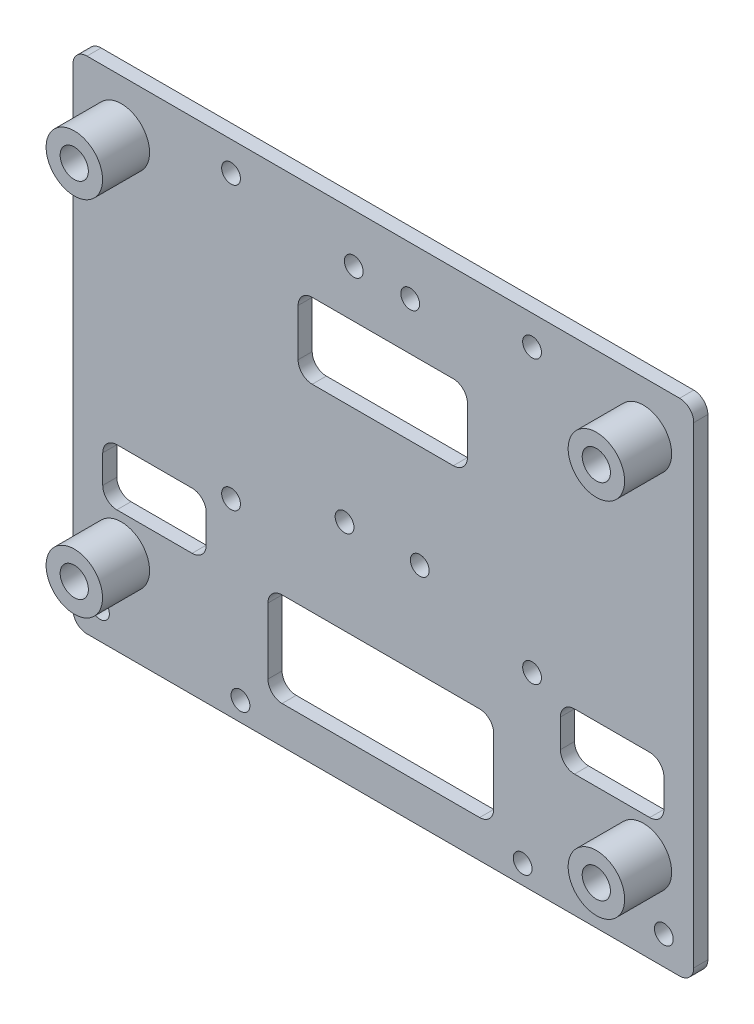
from build123d import *

# Parameters (mm, degrees)
SKETCH6_W           = 66
SKETCH6_H           = 53.2
SKETCH6_R           = 1
BOSS_EXTRUDE1_DEPTH = 1.5
SKETCH7_W           = 18
SKETCH7_H           = 8
SKETCH7_W_2         = 24
SKETCH7_H_2         = 10
SKETCH7_W_3         = 11
SKETCH7_H_3         = 6
CUT_EXTRUDE1_DEPTH  = 1.5
SKETCH8_R           = 3
BOSS_EXTRUDE2_DEPTH = 5
FILLET1_R           = 1.5
SKETCH9_R           = 1.5
CUT_EXTRUDE2_DEPTH  = 487.862929815


with BuildPart() as part:
    # Sketch6 → Boss-Extrude1 (new body)
    with BuildSketch(Plane.XY.offset(10)):
        with Locations((179.113788697, 411.579190598)):
            Rectangle(SKETCH6_W, SKETCH6_H)
        with Locations((175.972708226, 433.009408695)):
            Circle(SKETCH6_R, mode=Mode.SUBTRACT)
        with Locations((181.972708226, 433.009408695)):
            Circle(SKETCH6_R, mode=Mode.SUBTRACT)
        with Locations((174.991265937, 408.983186548)):
            Circle(SKETCH6_R, mode=Mode.SUBTRACT)
        with Locations((182.991265937, 408.983186548)):
            Circle(SKETCH6_R, mode=Mode.SUBTRACT)
        with Locations((162.926862189, 435.050185267)):
            Circle(SKETCH6_R, mode=Mode.SUBTRACT)
        with Locations((194.926862189, 435.050185267)):
            Circle(SKETCH6_R, mode=Mode.SUBTRACT)
        with Locations((162.926862189, 405.077351054)):
            Circle(SKETCH6_R, mode=Mode.SUBTRACT)
        with Locations((194.926862189, 405.077351054)):
            Circle(SKETCH6_R, mode=Mode.SUBTRACT)
        with Locations((163.926862189, 387.016819786)):
            Circle(SKETCH6_R, mode=Mode.SUBTRACT)
        with Locations((193.926862189, 387.016819786)):
            Circle(SKETCH6_R, mode=Mode.SUBTRACT)
        with Locations((148.99021815, 388.016819786)):
            Circle(SKETCH6_R, mode=Mode.SUBTRACT)
        with Locations((208.935821533, 388.016819786)):
            Circle(SKETCH6_R, mode=Mode.SUBTRACT)
    extrude(amount=BOSS_EXTRUDE1_DEPTH)

    # Sketch7 → Cut-Extrude1 (cut)
    with BuildSketch(Plane.XY.offset(11.5)):
        with Locations((179.055389508, 423.939252126)):
            Rectangle(SKETCH7_W, SKETCH7_H)
        with Locations((178.85068071, 393.944335229)):
            Rectangle(SKETCH7_W_2, SKETCH7_H_2)
        with Locations((203.439714031, 400.989756962)):
            Rectangle(SKETCH7_W_3, SKETCH7_H_3)
        with Locations((154.787863363, 400.989756962)):
            Rectangle(SKETCH7_W_3, SKETCH7_H_3)
    extrude(amount=-CUT_EXTRUDE1_DEPTH, mode=Mode.SUBTRACT)

    # Sketch8 → Boss-Extrude2 (add)
    with BuildSketch(Plane.XY.offset(11.5)):
        with Locations((151.266317417, 432.621241402)):
            Circle(SKETCH8_R)
        with Locations((206.766317417, 432.621241402)):
            Circle(SKETCH8_R)
        with Locations((206.766317417, 394.121241402)):
            Circle(SKETCH8_R)
        with Locations((151.266317417, 394.121241402)):
            Circle(SKETCH8_R)
    extrude(amount=BOSS_EXTRUDE2_DEPTH)

    # Fillet1
    fillet1_edges = [part.edges().sort_by_distance(p)[0] for p in [
        (146.113788697, 438.179190598, 10.75),
        (212.113788697, 438.179190598, 10.75),
        (170.055389508, 419.939252126, 10.75),
        (212.113788697, 384.979190598, 10.75),
        (170.055389508, 427.939252126, 10.75),
        (188.055389508, 427.939252126, 10.75),
        (146.113788697, 384.979190598, 10.75),
        (188.055389508, 419.939252126, 10.75),
        (166.85068071, 388.944335229, 10.75),
        (166.85068071, 398.944335229, 10.75),
        (190.85068071, 398.944335229, 10.75),
        (190.85068071, 388.944335229, 10.75),
        (197.939714031, 397.989756962, 10.75),
        (197.939714031, 403.989756962, 10.75),
        (208.939714031, 403.989756962, 10.75),
        (208.939714031, 397.989756962, 10.75),
        (160.287863363, 403.989756962, 10.75),
        (160.287863363, 397.989756962, 10.75),
        (149.287863363, 397.989756962, 10.75),
        (149.287863363, 403.989756962, 10.75),
    ]]
    fillet(fillet1_edges, radius=FILLET1_R)

    # Sketch9 → Cut-Extrude2 (cut, through all)
    with BuildSketch(Plane.XY.offset(16.5)):
        with Locations((151.258032405, 432.638183814)):
            Circle(SKETCH9_R)
        with Locations((206.758032405, 432.638183814)):
            Circle(SKETCH9_R)
        with Locations((206.758032405, 394.138183814)):
            Circle(SKETCH9_R)
        with Locations((151.258032405, 394.138183814)):
            Circle(SKETCH9_R)
    extrude(amount=-CUT_EXTRUDE2_DEPTH, mode=Mode.SUBTRACT)


solid = part.part
